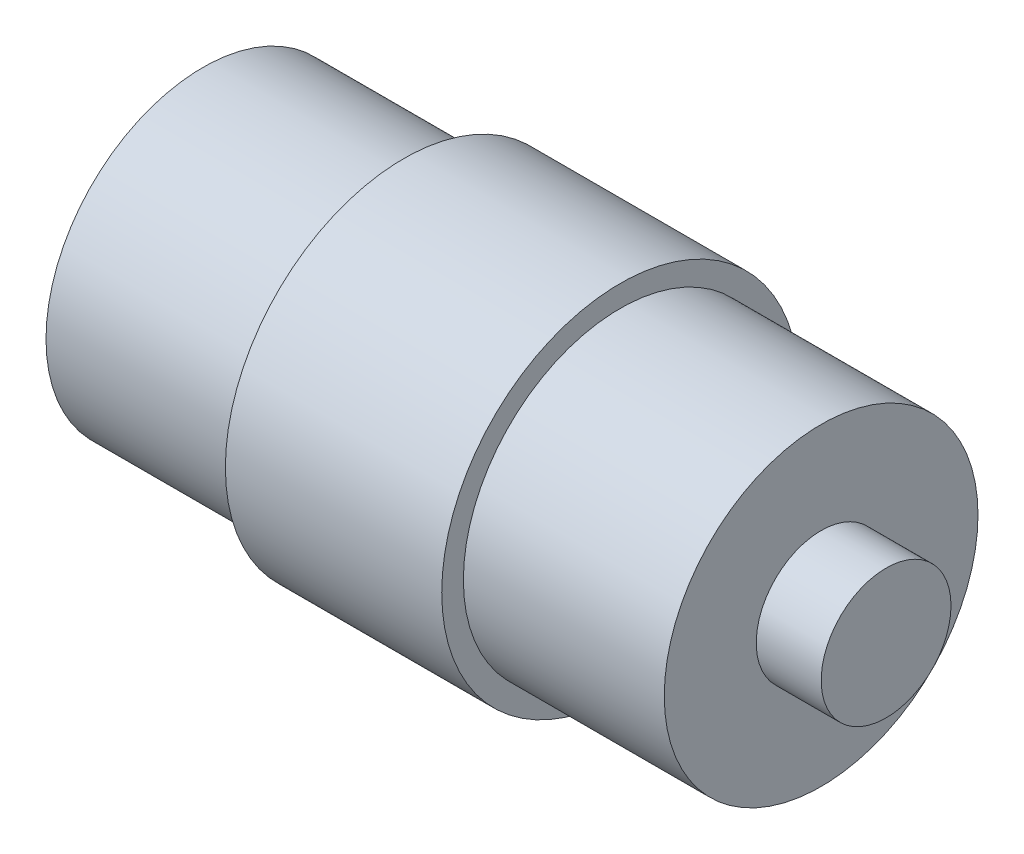
from build123d import *

# Parameters (mm, degrees)
COILBASE_R                     = 7.25
BOSS_EXTRUDE1_DEPTH            = 28.575
WIREHOUSING_EXTRUDE_DEPTH      = 5
WIREHOUSING_EXTRUDE_DEPTH_BACK = 5
WIREHOUSING_R                  = 8.25
BOSS_EXTRUDE3_DEPTH            = 17.2875
BOSS_EXTRUDE3_DEPTH_BACK       = 17.2875
CLEARANCEFORACTUATOR_R         = 3


with BuildPart() as part:
    # CoilBase → Boss-Extrude1 (new body)
    with BuildSketch(Plane(origin=(0, 0, 0), x_dir=(0, 0, -1), z_dir=(1, 0, 0))):
        Circle(COILBASE_R)
    extrude(amount=BOSS_EXTRUDE1_DEPTH)

    # WireHousing → WireHousing-Extrude (add, two sides: drawn at the far end of the back side and taken through both)
    with BuildSketch(Plane(origin=(14.29, 0, 0), x_dir=(0, 0, -1), z_dir=(1, 0, 0)).offset(-WIREHOUSING_EXTRUDE_DEPTH_BACK)):
        Circle(WIREHOUSING_R)
    extrude(amount=WIREHOUSING_EXTRUDE_DEPTH + WIREHOUSING_EXTRUDE_DEPTH_BACK)

    # ClearanceForActuator → Boss-Extrude3 (add, two sides: drawn at the far end of the back side and taken through both)
    with BuildSketch(Plane(origin=(14.29, 0, 0), x_dir=(0, 0, -1), z_dir=(1, 0, 0)).offset(-BOSS_EXTRUDE3_DEPTH_BACK)):
        Circle(CLEARANCEFORACTUATOR_R)
    extrude(amount=BOSS_EXTRUDE3_DEPTH + BOSS_EXTRUDE3_DEPTH_BACK)


solid = part.part
